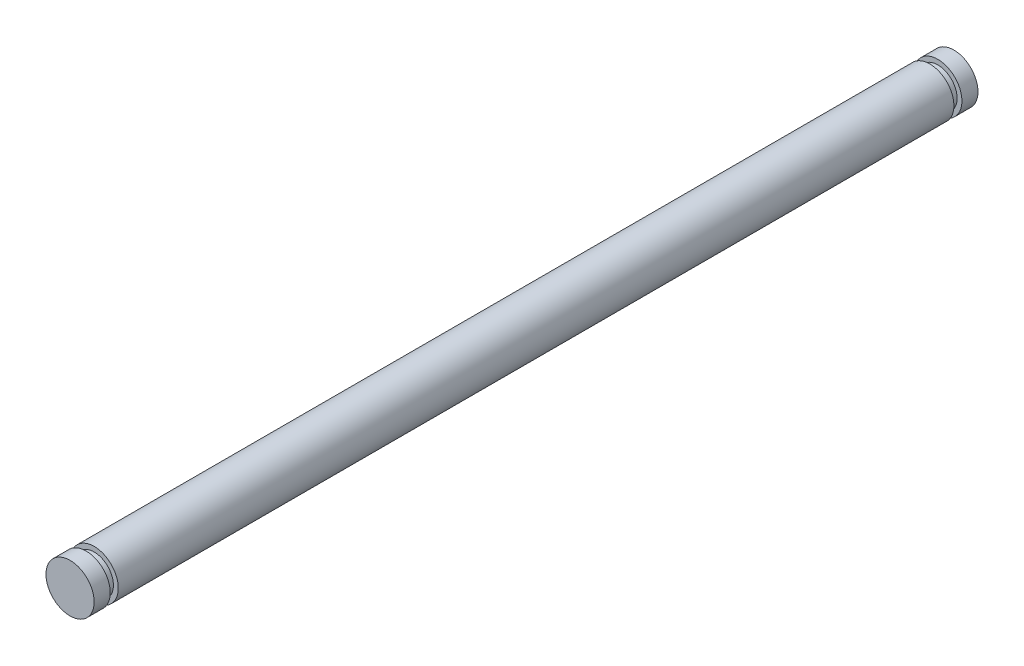
from build123d import *

# Parameters (mm, degrees)
SKETCH1_R           = 1.5
BOSS_EXTRUDE1_DEPTH = 55
SKETCH2_W           = 3.168024794
SKETCH2_H           = 0.5


with BuildPart() as part:
    # Sketch1 → Boss-Extrude1 (new body)
    with BuildSketch(Plane.XY):
        Circle(SKETCH1_R)
    extrude(amount=BOSS_EXTRUDE1_DEPTH)

    # Sketch2 → Cut-Revolve1 (revolve, cut)
    with BuildSketch(Plane(origin=(0, 0, 0), x_dir=(1, 0, 0), z_dir=(0, 1, 0))):
        with Locations((-2.784012397, -1.25)):
            Rectangle(SKETCH2_W, SKETCH2_H)
    cut_revolve1 = revolve(axis=Axis((0, 0, 0), (0, 0, 1)), mode=Mode.SUBTRACT)

    # Mirror1: Cut-Revolve1 across plane
    add(cut_revolve1.mirror(Plane.XY.offset(27.5)), mode=Mode.SUBTRACT)


solid = part.part
